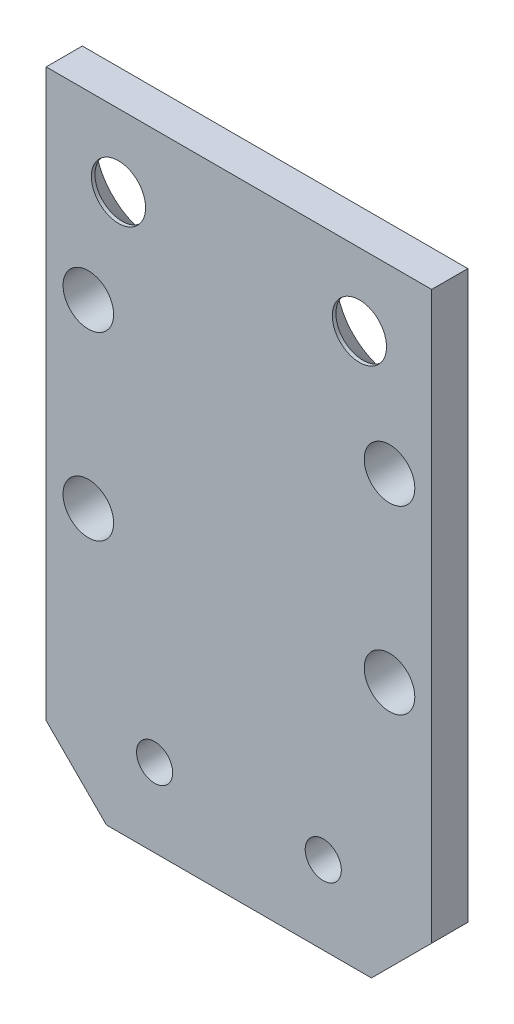
from build123d import *

# Parameters (mm, degrees)
SKETCH_1_R      = 2.1
SKETCH_1_R_2    = 1.5
SKETCH_1_R_3    = 2.25
EXTRUDE_1_DEPTH = 3
CHAMFER_2_SIZE  = 2.7
CHAMFER_3_SIZE  = 2.7


with BuildPart() as part:
    # 草图1 → 拉伸1 (new body)
    with BuildSketch(Plane.XY):
        Polygon((-16, -21), (-11, -26), (11, -26), (16, -21), (16, 26), (-16, 26), align=None)
        with Locations((-12.5, 11)):
            Circle(SKETCH_1_R, mode=Mode.SUBTRACT)
        with Locations((12.5, 11)):
            Circle(SKETCH_1_R, mode=Mode.SUBTRACT)
        with Locations((12.5, -4)):
            Circle(SKETCH_1_R, mode=Mode.SUBTRACT)
        with Locations((-12.5, -4)):
            Circle(SKETCH_1_R, mode=Mode.SUBTRACT)
        with Locations((-7, -19.5)):
            Circle(SKETCH_1_R_2, mode=Mode.SUBTRACT)
        with Locations((7, -19.5)):
            Circle(SKETCH_1_R_2, mode=Mode.SUBTRACT)
        with Locations((10, 20)):
            Circle(SKETCH_1_R_3, mode=Mode.SUBTRACT)
        with Locations((-10, 20)):
            Circle(SKETCH_1_R_3, mode=Mode.SUBTRACT)
    extrude(amount=EXTRUDE_1_DEPTH)

    # 倒角2
    chamfer_2_edges = [part.edges().sort_by_distance(p)[0] for p in [
        (7.75, 20, 0),
    ]]
    chamfer(chamfer_2_edges, length=CHAMFER_2_SIZE)

    # 倒角3
    chamfer_3_edges = [part.edges().sort_by_distance(p)[0] for p in [
        (-12.25, 20, 0),
    ]]
    chamfer(chamfer_3_edges, length=CHAMFER_3_SIZE)


solid = part.part
